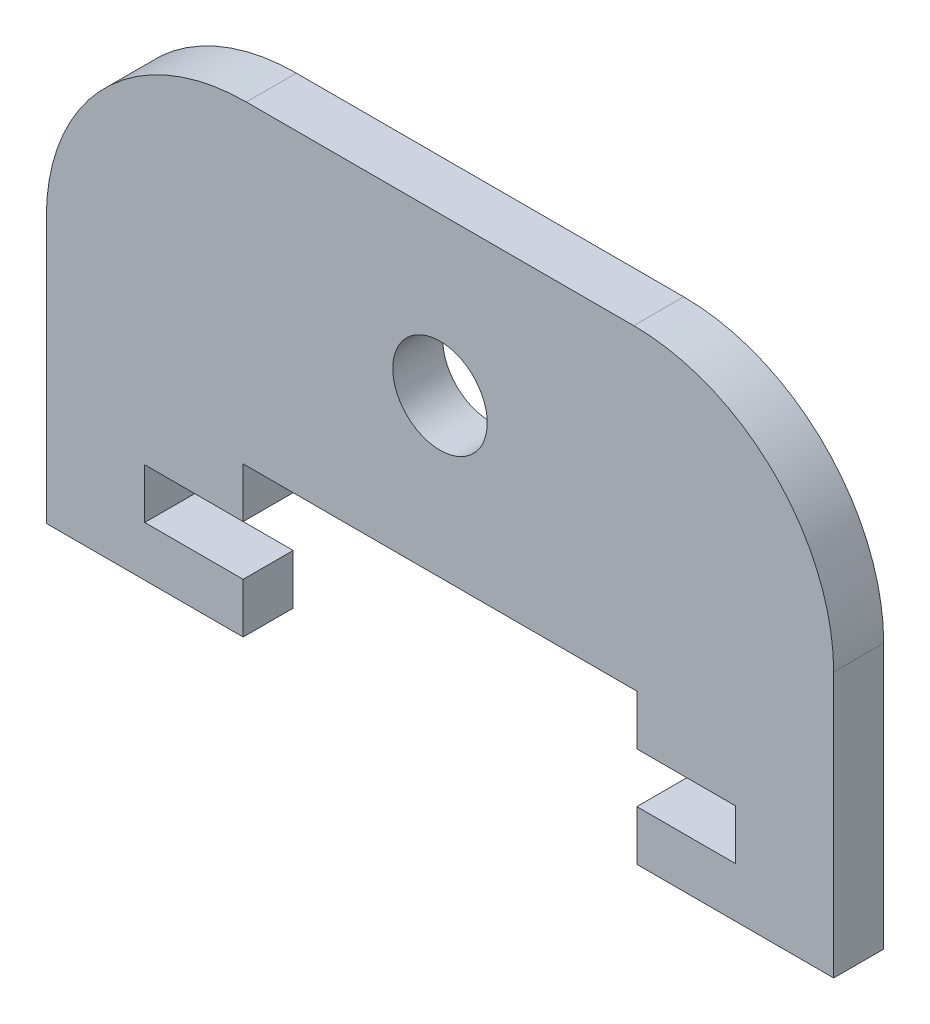
from build123d import *

# Parameters (mm, degrees)
BOSS_EXTRUDE1_DEPTH     = 6.35
CUT_EXTRUDE1_DEPTH      = 108.890326167
CUT_EXTRUDE1_DEPTH_BACK = 108.890326167
SKETCH2_R               = 5.999999938
FILLET1_R               = 25.4
CUT_EXTRUDE2_DEPTH      = 108.890326167
CUT_EXTRUDE2_DEPTH_BACK = 108.890326167
SKETCH3_W               = 12.499999987
SKETCH3_H               = 6.35


with BuildPart() as part:
    # Sketch1 → Boss-Extrude1 (new body)
    with BuildSketch(Plane.XY):
        Polygon((24.999999974, 0), (74.999999924, 0), (74.999999923, -6.35), (74.999999923, -19.05), (99.999999898, -19.05), (99.999999898, -6.35), (99.999999898, 0), (99.999999898, 40.00000001), (0, 40.00000001), (0, 0), (0, -6.35), (0, -19.05), (24.999999974, -19.05), (24.999999974, -6.35), align=None)
    extrude(amount=BOSS_EXTRUDE1_DEPTH)

    # Sketch2 → Cut-Extrude1 (cut, two sides: drawn at the far end of the back side and taken through both)
    with BuildSketch(Plane.XY.offset(6.35).offset(-CUT_EXTRUDE1_DEPTH_BACK)):
        with Locations((49.999999949, 20.000000005)):
            Circle(SKETCH2_R)
    extrude(amount=CUT_EXTRUDE1_DEPTH + CUT_EXTRUDE1_DEPTH_BACK, mode=Mode.SUBTRACT)

    # Fillet1
    fillet1_edges = [part.edges().sort_by_distance(p)[0] for p in [
        (0, 40.00000001, 3.175),
        (99.999999898, 40.00000001, 3.175),
    ]]
    fillet(fillet1_edges, radius=FILLET1_R)

    # Sketch3 → Cut-Extrude2 (cut, two sides: drawn at the far end of the back side and taken through both)
    with BuildSketch(Plane.XY.offset(6.35).offset(-CUT_EXTRUDE2_DEPTH_BACK)):
        with Locations((81.249999918, -9.525)):
            Rectangle(SKETCH3_W, SKETCH3_H)
        with Locations((18.749999981, -9.525)):
            Rectangle(SKETCH3_W, SKETCH3_H)
    extrude(amount=CUT_EXTRUDE2_DEPTH + CUT_EXTRUDE2_DEPTH_BACK, mode=Mode.SUBTRACT)


solid = part.part
